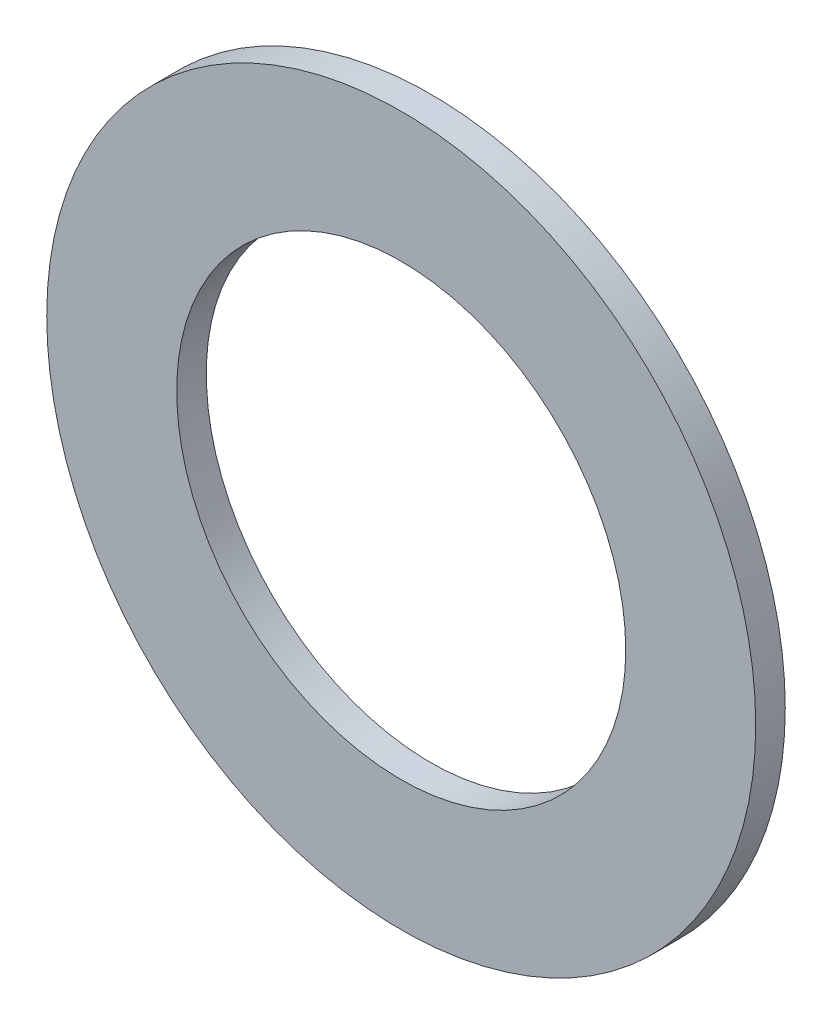
from build123d import *

# Parameters (mm, degrees)
SZKIC1_R                    = 12
SZKIC1_R_2                  = 7.6
DODANIE_WYCI_GNI_CIE1_DEPTH = 1


with BuildPart() as part:
    # Szkic1 → Dodanie-wyciągnięcie1 (new body)
    with BuildSketch(Plane.XY):
        Circle(SZKIC1_R)
        Circle(SZKIC1_R_2, mode=Mode.SUBTRACT)
    extrude(amount=DODANIE_WYCI_GNI_CIE1_DEPTH)


solid = part.part
